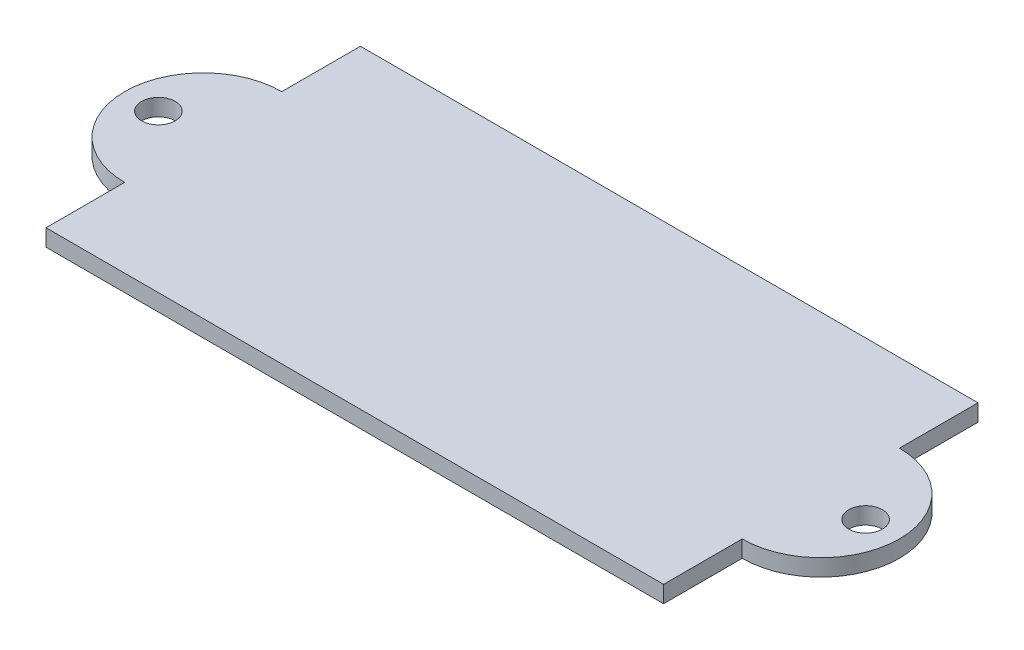
from build123d import *

# Parameters (mm, degrees)
SKETCH1_W           = 55
SKETCH1_H           = 28
BOSS_EXTRUDE1_DEPTH = 1.5
SKETCH4_R           = 1.5
CUT_EXTRUDE1_DEPTH  = 38.262581768


with BuildPart() as part:
    # Sketch1 → Boss-Extrude1 (new body)
    with BuildSketch(Plane(origin=(0, 0, 0), x_dir=(1, 0, 0), z_dir=(0, 1, 0))):
        Rectangle(SKETCH1_W, SKETCH1_H)
        with BuildLine():
            Line((-27.5, -7), (-27.5, 7))
            ThreePointArc((-27.5, 7), (-34.5, 0), (-27.5, -7))
        make_face()
        with BuildLine():
            ThreePointArc((27.5, -7), (34.5, 0), (27.5, 7))
            Line((27.5, 7), (27.5, -7))
        make_face()
    extrude(amount=-BOSS_EXTRUDE1_DEPTH)

    # Sketch4 → Cut-Extrude1 (cut, through all)
    with BuildSketch(Plane(origin=(0, 0, 0), x_dir=(1, 0, 0), z_dir=(0, 1, 0))):
        with Locations(Location((-31.49, 0, 0), (0, 0, 270))):
            Circle(SKETCH4_R)
        with Locations(Location((31.49, 0, 0), (0, 0, 270))):
            Circle(SKETCH4_R)
    extrude(amount=-CUT_EXTRUDE1_DEPTH, mode=Mode.SUBTRACT)


solid = part.part
